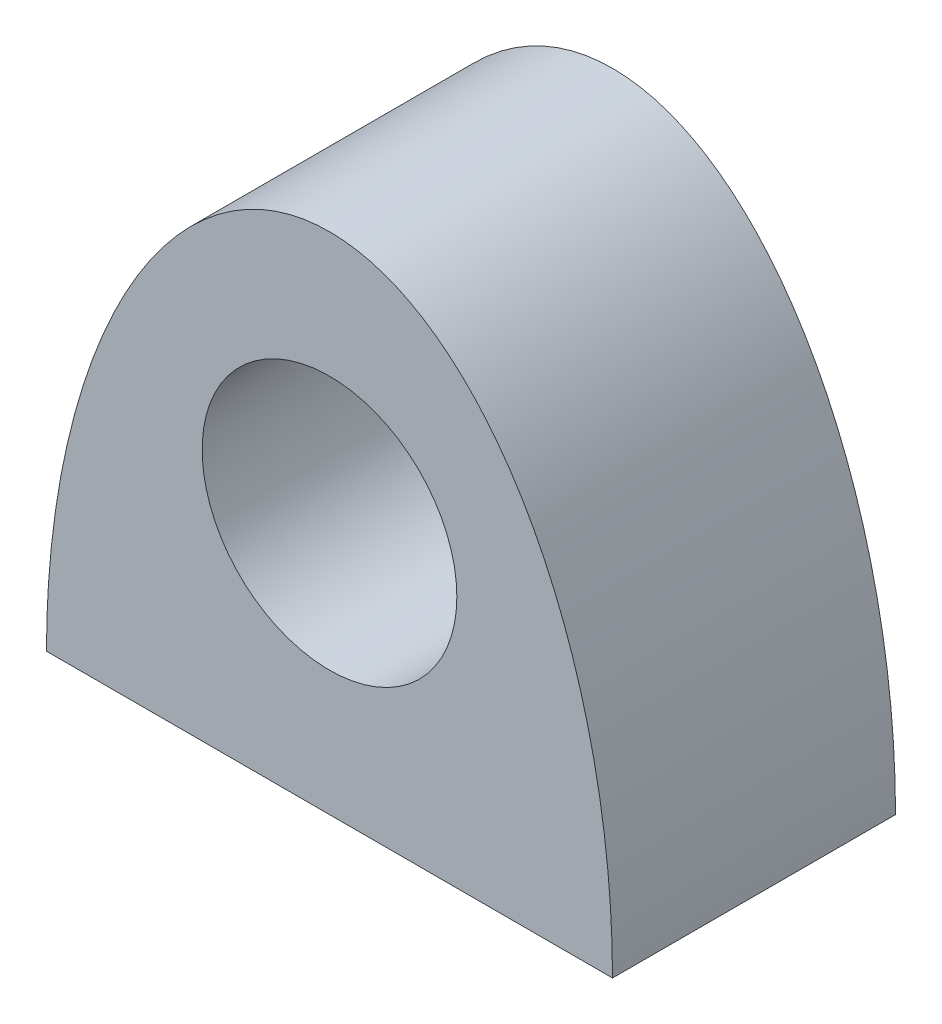
from build123d import *

# Parameters (mm, degrees)
SKETCH1_R           = 1.35
BOSS_EXTRUDE1_DEPTH = 3


with BuildPart() as part:
    # Sketch1 → Boss-Extrude1 (new body)
    with BuildSketch(Plane.XY):
        with BuildLine():
            Line((0, 0), (6, 0))
            add(Edge.make_bspline(
                [(6, 0), (6, 5.351351351), (3, 5.351351351), (0, 5.351351351), (0, 0)],
                knots=[1.570796327, 1.570796327, 1.570796327, 3.141592654, 3.141592654, 4.71238898, 4.71238898, 4.71238898], degree=2, weights=[1, 0.707106781, 1, 0.707106781, 1]))
        make_face()
        with Locations((3, 2.675675676)):
            Circle(SKETCH1_R, mode=Mode.SUBTRACT)
    extrude(amount=BOSS_EXTRUDE1_DEPTH)


solid = part.part
